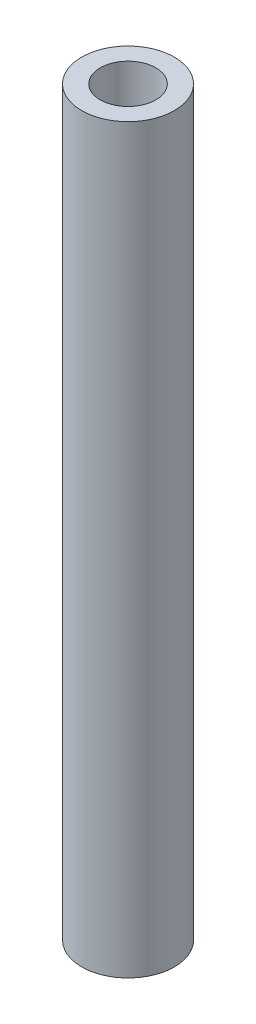
from build123d import *

# Parameters (mm, degrees)
SKETCH_1_R      = 2.5
SKETCH_1_R_2    = 1.5
EXTRUDE_1_DEPTH = 40


with BuildPart() as part:
    # 草图1 → 拉伸-薄壁1 (new body)
    with BuildSketch(Plane(origin=(0, 0, 0), x_dir=(1, 0, 0), z_dir=(0, 1, 0))):
        Circle(SKETCH_1_R)
        Circle(SKETCH_1_R_2, mode=Mode.SUBTRACT)
    extrude(amount=EXTRUDE_1_DEPTH)


solid = part.part
